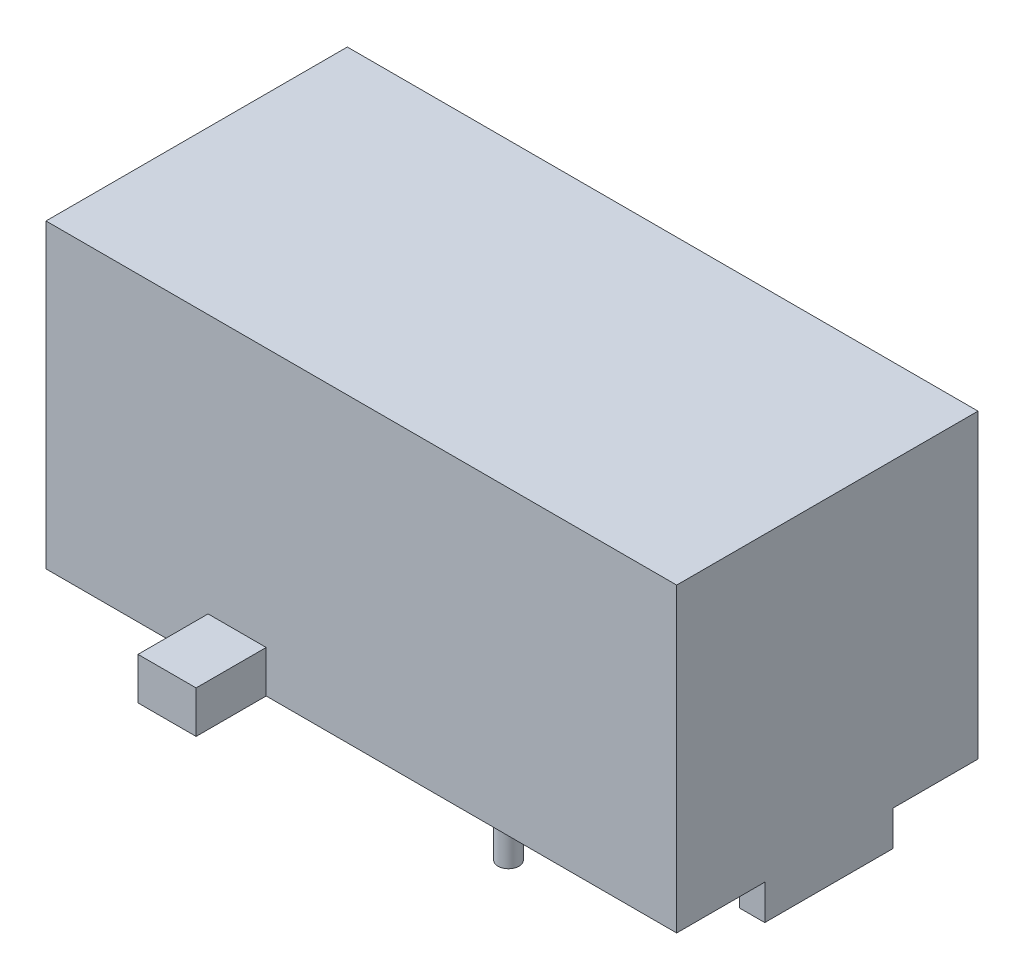
from build123d import *

# Parameters (mm, degrees)
SKETCH_1_W      = 43
SKETCH_1_H      = 43
EXTRUDE_1_DEPTH = 90
SKETCH_2_R      = 1.5
EXTRUDE_2_DEPTH = 29
SKETCH_3_W      = 3.599409295
SKETCH_3_H      = 18.326935395
EXTRUDE_3_DEPTH = 5
SKETCH_4_W      = 8.291811564
SKETCH_4_H      = 6.001856053
EXTRUDE_4_DEPTH = 10


with BuildPart() as part:
    # 草图1 → 凸台-拉伸1 (new body)
    with BuildSketch(Plane(origin=(0, 0, 0), x_dir=(0, 0, -1), z_dir=(1, 0, 0))):
        with Locations((-21.5, 21.5)):
            Rectangle(SKETCH_1_W, SKETCH_1_H)
    extrude(amount=EXTRUDE_1_DEPTH)

    # 草图2 → 凸台-拉伸2 (add)
    with BuildSketch(Plane.XZ):
        with Locations(Location((40, 17, 0), (0, 0, 90))):
            Circle(SKETCH_2_R)
    extrude(amount=EXTRUDE_2_DEPTH)

    # 草图3 → 凸台-拉伸3 (add)
    with BuildSketch(Plane.XZ):
        with Locations((88.200295353, 21.266426497)):
            Rectangle(SKETCH_3_W, SKETCH_3_H)
    extrude(amount=EXTRUDE_3_DEPTH)

    # 草图4 → 凸台-拉伸4 (add)
    with BuildSketch(Plane.XY.offset(43)):
        with Locations((27.274280527, 3.000928027)):
            Rectangle(SKETCH_4_W, SKETCH_4_H)
    extrude(amount=EXTRUDE_4_DEPTH)


solid = part.part
